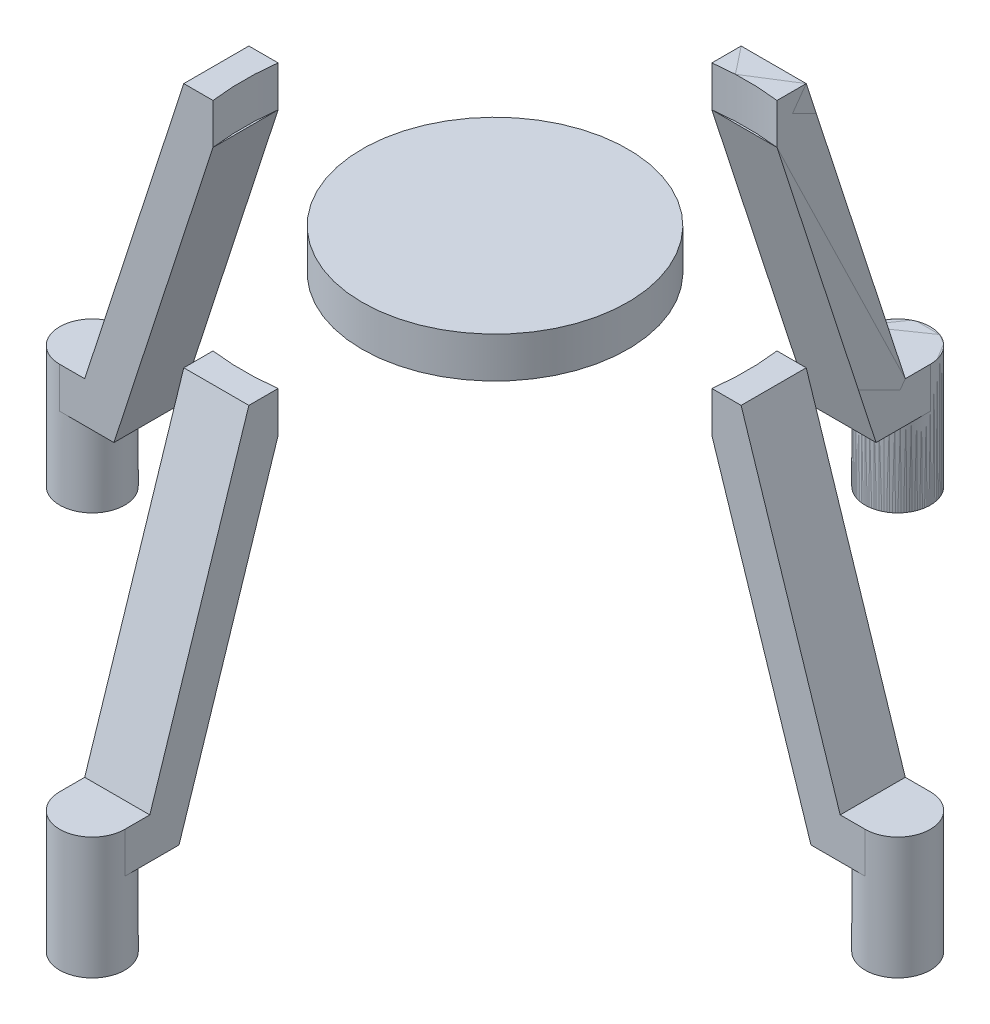
from build123d import *

# Parameters (mm, degrees)
SKETCH1_R           = 18.55
SKETCH1_R_2         = 12.55
BOSS_EXTRUDE1_DEPTH = 3
SKETCH4_W           = 4.8
SKETCH4_H           = 3
BOSS_EXTRUDE4_DEPTH = 20.55
BOSS_EXTRUDE6_DEPTH = 4.8
SKETCH3_R           = 2.4
BOSS_EXTRUDE7_DEPTH = 6
BOSS_EXTRUDE8_START = -3
BOSS_EXTRUDE8_DEPTH = 3
CIRPATTERN6_COUNT   = 2
CUT_EXTRUDE1_START  = -3
SKETCH10_R          = 18.55
CUT_EXTRUDE1_DEPTH  = 3
SKETCH11_R          = 9.796232486
BOSS_EXTRUDE9_DEPTH = 3
CIRPATTERN7_COUNT   = 4


with BuildPart() as part:
    # Sketch1 → Boss-Extrude1 (new body)
    with BuildSketch(Plane(origin=(0, 0, 0), x_dir=(1, 0, 0), z_dir=(0, 1, 0))):
        with Locations(Location((0, 0, 0), (0, 0, 270))):
            Circle(SKETCH1_R)
        with Locations(Location((0, 0, 0), (0, 0, 270))):
            Circle(SKETCH1_R_2, mode=Mode.SUBTRACT)
    extrude(amount=BOSS_EXTRUDE1_DEPTH)

    # Sketch4 → Boss-Extrude4 (add)
    with BuildSketch(Plane.XY):
        with Locations((0, 1.5)):
            Rectangle(SKETCH4_W, SKETCH4_H)
    boss_extrude4 = extrude(amount=-BOSS_EXTRUDE4_DEPTH)

    # Sketch8 → Boss-Extrude6 (add)
    with BuildSketch(Plane(origin=(2.4, 0, 0), x_dir=(0, 0, -1), z_dir=(1, 0, 0))):
        Polygon((18.394088724, 0), (25.7, -22.5), (28.830032779, -22.5), (20.55, 3), align=None)
    boss_extrude6 = extrude(amount=-BOSS_EXTRUDE6_DEPTH)

    # Sketch3 → Boss-Extrude7 (add)
    with BuildSketch(Plane(origin=(0, -22.5, 0), x_dir=(-1, 0, 0), z_dir=(0, -1, 0))):
        with Locations(Location((0, 29.7, 0), (0, 0, 338.747030464))):
            Circle(SKETCH3_R)
    boss_extrude7 = extrude(amount=BOSS_EXTRUDE7_DEPTH)

    # Sketch7 → Boss-Extrude8 (add)
    with BuildSketch(Plane(origin=(0, -22.5, 0), x_dir=(-1, 0, 0), z_dir=(0, -1, 0)).offset(BOSS_EXTRUDE8_START)):
        with BuildLine():
            Line((-2.4, 29.7), (-2.4, 25.7))
            Line((-2.4, 25.7), (2.4, 25.7))
            Line((2.4, 25.7), (2.4, 29.7))
            ThreePointArc((2.4, 29.7), (0, 32.1), (-2.4, 29.7))
        make_face()
    boss_extrude8 = extrude(amount=BOSS_EXTRUDE8_DEPTH)

    # CirPattern6: Boss-Extrude4, Boss-Extrude6, Boss-Extrude7, Boss-Extrude8 ×2 about axis
    cirpattern6_axis = Axis((0, 0, 0), (0, 1, 0))
    add([boss_extrude4.rotate(cirpattern6_axis, i * 360 / CIRPATTERN6_COUNT) for i in range(1, CIRPATTERN6_COUNT)])
    add([boss_extrude6.rotate(cirpattern6_axis, i * 360 / CIRPATTERN6_COUNT) for i in range(1, CIRPATTERN6_COUNT)])
    add([boss_extrude7.rotate(cirpattern6_axis, i * 360 / CIRPATTERN6_COUNT) for i in range(1, CIRPATTERN6_COUNT)])
    add([boss_extrude8.rotate(cirpattern6_axis, i * 360 / CIRPATTERN6_COUNT) for i in range(1, CIRPATTERN6_COUNT)])

    # Sketch10 → Cut-Extrude1 (cut)
    with BuildSketch(Plane(origin=(0, 3, 0), x_dir=(1, 0, 0), z_dir=(0, 1, 0)).offset(CUT_EXTRUDE1_START)):
        Circle(SKETCH10_R)
    extrude(amount=CUT_EXTRUDE1_DEPTH, mode=Mode.SUBTRACT)


with BuildPart() as cut_extrude1_piece_1:
    # of the separate pieces the step leaves, piece 1, a body of its own (cut_extrude1_pieces)
    add(part.part.solids().sort_by_distance((2.4, 0, -18.394088724))[0])


with BuildPart() as cut_extrude1_piece_2:
    # of the separate pieces the step leaves, piece 2, a body of its own (cut_extrude1_pieces)
    add(part.part.solids().sort_by_distance((-2.4, 0, 18.394088724))[0])


with BuildPart() as body_3:
    # Sketch11 → Boss-Extrude9 (new body)
    with BuildSketch(Plane(origin=(0, 0, 0), x_dir=(1, 0, 0), z_dir=(0, 1, 0))):
        with Locations(Location((0, 0, 0), (0, 0, 270))):
            Circle(SKETCH11_R)
    extrude(amount=BOSS_EXTRUDE9_DEPTH)


with BuildPart() as cirpattern7_1:
    # CirPattern7: pattern copy
    add(cut_extrude1_piece_2.part.rotate(Axis((0, 0, 0), (0, 1, 0)), 1 * 360 / CIRPATTERN7_COUNT))


with BuildPart() as cirpattern7_2:
    # CirPattern7: pattern copy
    add(cut_extrude1_piece_2.part.rotate(Axis((0, 0, 0), (0, 1, 0)), 2 * 360 / CIRPATTERN7_COUNT))


with BuildPart() as cirpattern7_3:
    # CirPattern7: pattern copy
    add(cut_extrude1_piece_2.part.rotate(Axis((0, 0, 0), (0, 1, 0)), 3 * 360 / CIRPATTERN7_COUNT))


solid = Compound([cut_extrude1_piece_1.part, cut_extrude1_piece_2.part, body_3.part, cirpattern7_1.part, cirpattern7_2.part, cirpattern7_3.part])
